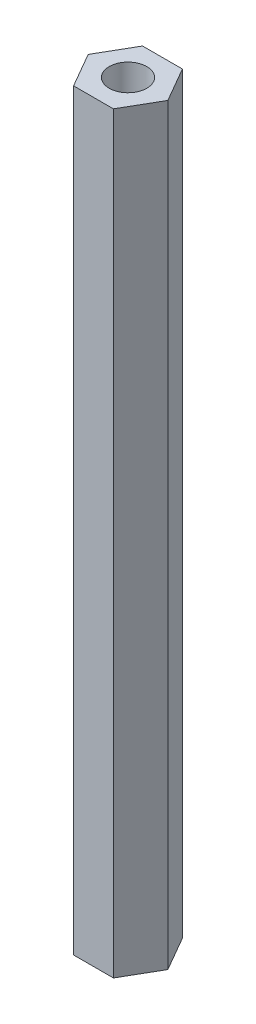
from build123d import *

# Parameters (mm, degrees)
BOSS_EXTRUDE1_DEPTH = 60
SKETCH2_R           = 1.5
CUT_EXTRUDE1_DEPTH  = 10


with BuildPart() as part:
    # Sketch1 → Boss-Extrude1 (new body)
    with BuildSketch(Plane(origin=(0, 0, 0), x_dir=(1, 0, 0), z_dir=(0, 1, 0))):
        Polygon((3.175426481, 0), (1.58771324, 2.75), (-1.58771324, 2.75), (-3.175426481, 0), (-1.58771324, -2.75), (1.58771324, -2.75), align=None)
    extrude(amount=BOSS_EXTRUDE1_DEPTH)

    # Sketch2 → Cut-Extrude1 (cut)
    with BuildSketch(Plane(origin=(0, 60, 0), x_dir=(1, 0, 0), z_dir=(0, 1, 0))):
        with Locations(Location((0, 0, 0), (0, 0, 270))):
            Circle(SKETCH2_R)
    cut_extrude1 = extrude(amount=-CUT_EXTRUDE1_DEPTH, mode=Mode.SUBTRACT)

    # Mirror1: Cut-Extrude1 across plane
    add(cut_extrude1.mirror(Plane(origin=(0, 30, 0), x_dir=(0, 0, 1), z_dir=(0, -1, 0))), mode=Mode.SUBTRACT)


solid = part.part
